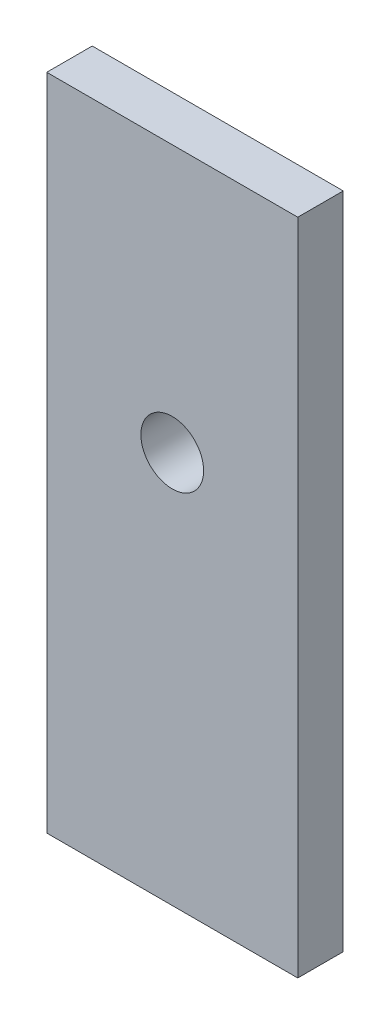
from build123d import *

# Parameters (mm, degrees)
SKETCH_1_W      = 32
SKETCH_1_H      = 84
SKETCH_1_R      = 4
EXTRUDE_1_DEPTH = 5.8


with BuildPart() as part:
    # Эскиз1 → Бобышка-Вытянуть1 (new body)
    with BuildSketch(Plane.XY):
        with Locations((16, 42)):
            Rectangle(SKETCH_1_W, SKETCH_1_H)
        with Locations((16, 50)):
            Circle(SKETCH_1_R, mode=Mode.SUBTRACT)
    extrude(amount=EXTRUDE_1_DEPTH)


solid = part.part
